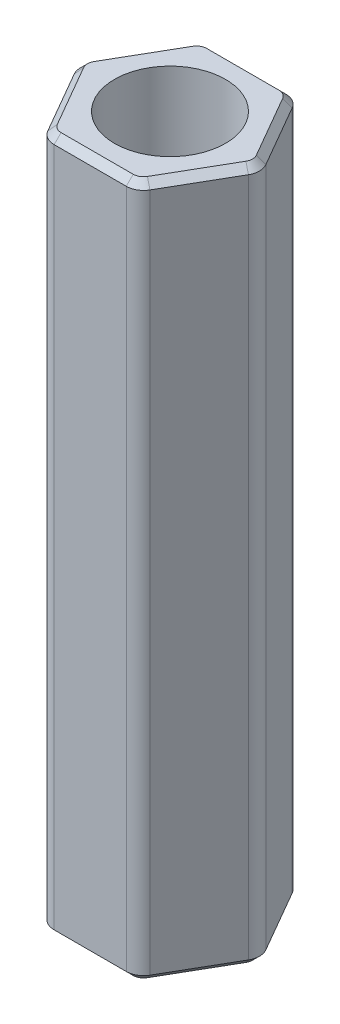
from build123d import *

# Parameters (mm, degrees)
BOSS_EXTRUDE1_DEPTH = 20
SKETCH2_R           = 1.6
CUT_EXTRUDE1_DEPTH  = 21.306238779
FILLET1_R           = 0.5
CHAMFER1_SIZE       = 0.2


with BuildPart() as part:
    # Sketch1 → Boss-Extrude1 (new body)
    with BuildSketch(Plane(origin=(0, 0, 0), x_dir=(1, 0, 0), z_dir=(0, 1, 0))):
        Polygon((1.327905619, -2.3), (2.655811238, 0), (1.327905619, 2.3), (-1.327905619, 2.3), (-2.655811238, 0), (-1.327905619, -2.3), align=None)
    extrude(amount=BOSS_EXTRUDE1_DEPTH)

    # Sketch2 → Cut-Extrude1 (cut, through all)
    with BuildSketch(Plane(origin=(0, 20, 0), x_dir=(1, 0, 0), z_dir=(0, 1, 0))):
        with Locations(Location((0, 0, 0), (0, 0, 270))):
            Circle(SKETCH2_R)
    extrude(amount=-CUT_EXTRUDE1_DEPTH, mode=Mode.SUBTRACT)

    # Fillet1
    fillet1_edges = [part.edges().sort_by_distance(p)[0] for p in [
        (-1.327905619, 10, 2.3),
        (-2.655811238, 10, 0),
        (-1.327905619, 10, -2.3),
        (1.327905619, 10, -2.3),
        (2.655811238, 10, 0),
        (1.327905619, 10, 2.3),
    ]]
    fillet(fillet1_edges, radius=FILLET1_R)

    # Chamfer1
    chamfer1_edges = [part.edges().sort_by_distance(p)[0] for p in [
        (0, 0, 2.3),
        (0, 20, 2.3),
        (-1.991858429, 0, 1.15),
        (-1.991858429, 0, -1.15),
        (0, 0, -2.3),
        (1.991858429, 0, -1.15),
        (1.991858429, 0, 1.15),
        (1.289230485, 0, 2.233012702),
        (2.578460969, 0, 0),
        (1.289230485, 0, -2.233012702),
        (-1.289230485, 0, -2.233012702),
        (-2.578460969, 0, 0),
        (-1.289230485, 0, 2.233012702),
        (-1.991858429, 20, 1.15),
        (1.991858429, 20, 1.15),
        (1.991858429, 20, -1.15),
        (0, 20, -2.3),
        (-1.991858429, 20, -1.15),
        (1.289230485, 20, 2.233012702),
        (2.578460969, 20, 0),
        (1.289230485, 20, -2.233012702),
        (-1.289230485, 20, -2.233012702),
        (-2.578460969, 20, 0),
        (-1.289230485, 20, 2.233012702),
    ]]
    chamfer(chamfer1_edges, length=CHAMFER1_SIZE)


solid = part.part
